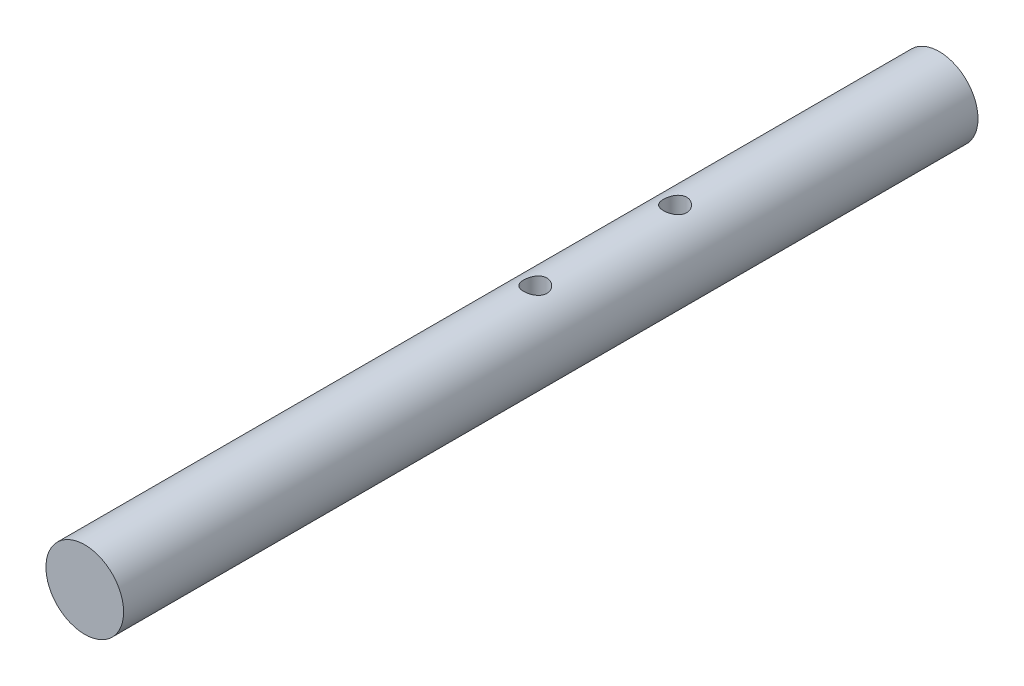
from build123d import *

# Parameters (mm, degrees)
SKETCH1_R               = 5
BOSS_EXTRUDE1_DEPTH     = 55
CUT_EXTRUDE1_DEPTH      = 56.452682532
CUT_EXTRUDE1_DEPTH_BACK = 56.452682532
SKETCH2_R               = 1.5


with BuildPart() as part:
    # Sketch1 → Boss-Extrude1 (new, symmetric)
    with BuildSketch(Plane.XY):
        Circle(SKETCH1_R)
    extrude(amount=BOSS_EXTRUDE1_DEPTH, both=True)

    # Sketch2 → Cut-Extrude1 (cut, two sides: drawn at the far end of the back side and taken through both)
    with BuildSketch(Plane(origin=(0, 0, 0), x_dir=(1, 0, 0), z_dir=(0, 1, 0)).offset(-CUT_EXTRUDE1_DEPTH_BACK)):
        with Locations(Location((0, 21, 0), (0, 0, 270))):
            Circle(SKETCH2_R)
        with Locations(Location((0, 3, 0), (0, 0, 270))):
            Circle(SKETCH2_R)
    extrude(amount=CUT_EXTRUDE1_DEPTH + CUT_EXTRUDE1_DEPTH_BACK, mode=Mode.SUBTRACT)


solid = part.part
